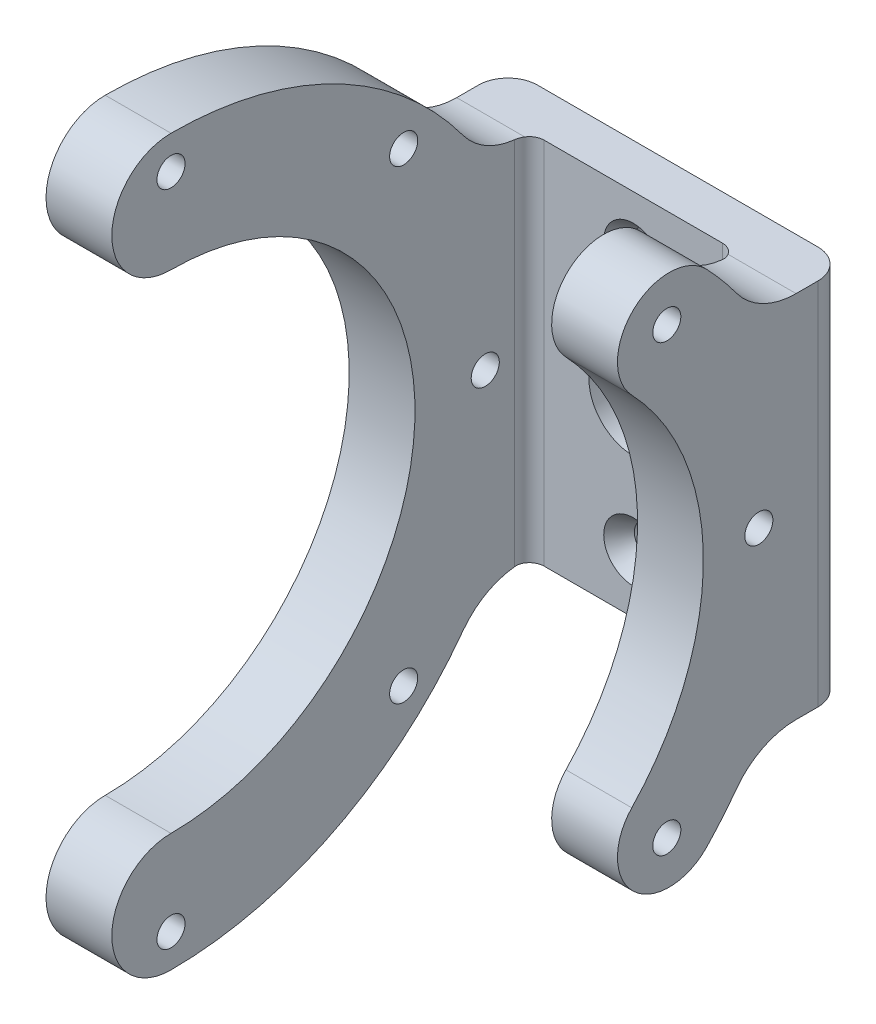
from build123d import *

# Parameters (mm, degrees)
SKETCH_1_W               = 45.9
SKETCH_1_H               = 49.9
EXTRUDE_1_DEPTH          = 6
SKETCH_2_R               = 1.9
EXTRUDE_2_DEPTH          = 8.9
EXTRUDE_START            = -8.9
SKETCH_3_R               = 1.9
EXTRUDE_3_DEPTH          = 8.9
FILLET_3_R               = 10
CUT_EXTRUDE_START        = -10
SKETCH_6_R               = 1.9
CUT_EXTRUDE_2_DEPTH      = 10
SKETCH_7_W               = 45.9
SKETCH_7_H               = 49.9
CUT_EXTRUDE_3_DEPTH      = 5
FILLET_4_R               = 4
SKETCH_8_W               = 28.1
SKETCH_8_H               = 49.9
EXTRUDE_5_DEPTH          = 5
FILLET_5_R               = 2
SKETCH_11_R              = 2.25
CUT_EXTRUDE_4_DEPTH      = 31
CUT_EXTRUDE_1_DEPTH      = 66
CUT_EXTRUDE_1_DEPTH_BACK = 70


with BuildPart() as part:
    # 草图1 → 凸台-拉伸1 (new body)
    with BuildSketch(Plane.XY):
        with Locations((22.95, -24.95)):
            Rectangle(SKETCH_1_W, SKETCH_1_H)
    extrude(amount=EXTRUDE_1_DEPTH)

    # 草图2 → 凸台-拉伸2 (add)
    with BuildSketch(Plane(origin=(45.9, 0, 0), x_dir=(0, 0, -1), z_dir=(1, 0, 0))):
        with BuildLine():
            Line((-6, 0), (-17.3, 0))
            ThreePointArc((-17.3, 0), (-20.410567122, 4.633542967), (-24.02783532, 8.883333436))
            ThreePointArc((-24.02783532, 8.883333436), (-33.92465453, 9.113485719), (-34.154806758, -0.783333492))
            ThreePointArc((-34.154806758, -0.783333492), (-24.472236128, -24.949999926), (-34.154806656, -49.116666401))
            ThreePointArc((-34.154806656, -49.116666401), (-33.924654493, -59.013485754), (-24.027835147, -58.783333255))
            ThreePointArc((-24.027835147, -58.783333255), (-20.410567046, -54.533542867), (-17.3, -49.9))
            Line((-17.3, -49.9), (-6, -49.9))
            Line((-6, -49.9), (-6, 0))
        make_face()
        with Locations(Location((-16.972236128, -24.95, 0), (0, 0, 90))):
            Circle(SKETCH_2_R, mode=Mode.SUBTRACT)
        with Locations(Location((-29.420197927, 5.1020382, 0), (0, 0, 90))):
            Circle(SKETCH_2_R, mode=Mode.SUBTRACT)
        with Locations(Location((-29.420197927, -55.0020382, 0), (0, 0, 90))):
            Circle(SKETCH_2_R, mode=Mode.SUBTRACT)
    extrude(amount=-EXTRUDE_2_DEPTH)

    # 草图3 → 凸台-拉伸3 (add)
    with BuildSketch(Plane.ZY.offset(EXTRUDE_START)):
        with BuildLine():
            Line((6, -49.9), (17.3, -49.9))
            ThreePointArc((17.3, -49.9), (62.08503163, -73.880290206), (104.061658089, -45.267072848))
            ThreePointArc((104.061658089, -45.267072848), (100.098824974, -34.670094153), (89.501846395, -38.63292758))
            ThreePointArc((89.501846395, -38.63292758), (26.472236128, -24.950000045), (89.501846358, -11.267072337))
            ThreePointArc((89.501846358, -11.267072337), (100.09882522, -15.229905735), (104.061657827, -4.632926576))
            ThreePointArc((104.061657827, -4.632926576), (62.085031314, 23.980290223), (17.3, 0))
            Line((17.3, 0), (6, 0))
            Line((6, 0), (6, -49.9))
        make_face()
        with Locations(Location((90.93848789, 6.516251763, 0), (0, 0, 270))):
            Circle(SKETCH_3_R, mode=Mode.SUBTRACT)
        with Locations(Location((28.005984365, -56.416251763, 0), (0, 0, 270))):
            Circle(SKETCH_3_R, mode=Mode.SUBTRACT)
        with Locations(Location((16.972236128, -24.95, 0), (0, 0, 90))):
            Circle(SKETCH_3_R, mode=Mode.SUBTRACT)
        with Locations(Location((59.472236128, -69.45, 0), (0, 0, 270))):
            Circle(SKETCH_3_R, mode=Mode.SUBTRACT)
        with Locations(Location((90.93848789, -56.416251763, 0), (0, 0, 270))):
            Circle(SKETCH_3_R, mode=Mode.SUBTRACT)
        with Locations(Location((28.005984365, 6.516251763, 0), (0, 0, 270))):
            Circle(SKETCH_3_R, mode=Mode.SUBTRACT)
        with Locations(Location((59.472236128, 19.55, 0), (0, 0, 270))):
            Circle(SKETCH_3_R, mode=Mode.SUBTRACT)
    extrude(amount=EXTRUDE_3_DEPTH)

    # 圆角3
    fillet_3_edges = [part.edges().sort_by_distance(p)[0] for p in [
        (41.45, 0, 17.3),
        (41.45, -49.9, 17.3),
        (4.45, -49.9, 17.3),
        (4.45, 0, 17.3),
    ]]
    fillet(fillet_3_edges, radius=FILLET_3_R)

    # 草图6 → 切除-拉伸2 (cut)
    # profile 1 of 2: a face of its own
    with BuildSketch(Plane.ZY.offset(CUT_EXTRUDE_START)):
        with BuildLine():
            ThreePointArc((104.061657942, -4.632926829), (85.981321722, 16.260051941), (59.472232168, 24.05))
            ThreePointArc((59.472232168, 24.05), (65.12908684, 21.706854481), (67.472232822, 16.05))
            ThreePointArc((67.472232822, 16.05), (65.129087169, 10.393145848), (59.472233099, 8.05))
            ThreePointArc((59.472233099, 8.05), (77.32529362, 2.803708548), (89.501846738, -11.267073171))
            ThreePointArc((89.501846738, -11.267073171), (100.098825511, -15.229905602), (104.061657942, -4.632926829))
        make_face()
        with Locations((90.93848789, 6.516251763)):
            Circle(SKETCH_6_R, mode=Mode.SUBTRACT)
    # profile 2 of 2: a face of its own
    with BuildSketch(Plane.ZY.offset(CUT_EXTRUDE_START)):
        with BuildLine():
            ThreePointArc((89.501846738, -38.632926829), (77.325293679, -52.70370851), (59.472233238, -57.95))
            ThreePointArc((59.472233238, -57.95), (65.129087219, -60.293145898), (67.472232822, -65.95))
            ThreePointArc((67.472232822, -65.95), (65.129086835, -71.606854486), (59.472232153, -73.95))
            ThreePointArc((59.472232153, -73.95), (85.981321716, -66.160051945), (104.061657942, -45.267073171))
            ThreePointArc((104.061657942, -45.267073171), (100.098825511, -34.670094398), (89.501846738, -38.632926829))
        make_face()
        with Locations((90.93848789, -56.416251763)):
            Circle(SKETCH_6_R, mode=Mode.SUBTRACT)
    extrude(amount=CUT_EXTRUDE_2_DEPTH, mode=Mode.SUBTRACT)


with BuildPart() as cut_extrude_2_kept_piece:
    # of the separate pieces the step leaves, the one the design keeps (cut_extrude_2_pieces_kept)
    add(part.part.solids().sort_by_distance((0, 0, 11.938064209))[0])

    # 草图7 → 切除-拉伸3 (cut)
    with BuildSketch(Plane(origin=(0, 0, 0), x_dir=(-1, 0, 0), z_dir=(0, 0, -1))):
        with Locations((-22.95, -24.95)):
            Rectangle(SKETCH_7_W, SKETCH_7_H)
    extrude(amount=-CUT_EXTRUDE_3_DEPTH, mode=Mode.SUBTRACT)

    # 圆角4
    fillet_4_edges = [cut_extrude_2_kept_piece.edges().sort_by_distance(p)[0] for p in [
        (45.9, -24.95, 5),
        (0, -24.95, 5),
    ]]
    fillet(fillet_4_edges, radius=FILLET_4_R)

    # 草图8 → 凸台-拉伸5 (add)
    with BuildSketch(Plane.XY.offset(6)):
        with Locations((22.95, -24.95)):
            Rectangle(SKETCH_8_W, SKETCH_8_H)
    extrude(amount=EXTRUDE_5_DEPTH)

    # 圆角5
    fillet_5_edges = [cut_extrude_2_kept_piece.edges().sort_by_distance(p)[0] for p in [
        (37, -24.95, 11),
        (8.9, -24.95, 11),
    ]]
    fillet(fillet_5_edges, radius=FILLET_5_R)

    # 草图11 → 切除-拉伸4 (cut)
    with BuildSketch(Plane.XY.offset(11)):
        with Locations((22.95, -7.7)):
            Circle(SKETCH_11_R)
        with Locations((22.95, -42.2)):
            Circle(SKETCH_11_R)
    extrude(amount=-CUT_EXTRUDE_4_DEPTH, mode=Mode.SUBTRACT)

    # 草图4 → 切除-拉伸1 (cut, two sides: drawn at the far end of the back side and taken through both)
    with BuildSketch(Plane.XY.offset(6).offset(-CUT_EXTRUDE_1_DEPTH_BACK)):
        with BuildLine():
            ThreePointArc((28.95, -24.95), (27.192640687, -20.707359313), (22.95, -18.95))
            Line((22.95, -18.95), (22.95, -30.95))
            ThreePointArc((22.95, -30.95), (27.192640687, -29.192640687), (28.95, -24.95))
        make_face()
        with BuildLine():
            Line((22.95, -30.95), (22.95, -18.95))
            ThreePointArc((22.95, -18.95), (16.95, -24.95), (22.95, -30.95))
        make_face()
    extrude(amount=CUT_EXTRUDE_1_DEPTH + CUT_EXTRUDE_1_DEPTH_BACK, mode=Mode.SUBTRACT)

    # 草图12 → 切除-旋转1 (revolve, cut)
    with BuildSketch(Plane.ZY.offset(-22.95), mode=Mode.PRIVATE) as cut_revolve_1_sk:
        Polygon((8.4, -7.7), (11, -7.7), (11, -5.45), (11, -3.7), (8.4, -5.6), align=None)
    cut_revolve_1 = revolve(cut_revolve_1_sk.sketch.rotate(Axis((22.95, -7.7, 5), (0, 0, 1)), 270), axis=Axis((22.95, -7.7, 5), (0, 0, 1)), mode=Mode.SUBTRACT)

    # 镜向2: 切除-旋转1 across plane
    add(cut_revolve_1.mirror(Plane.ZX.offset(-24.95)), mode=Mode.SUBTRACT)


solid = cut_extrude_2_kept_piece.part
